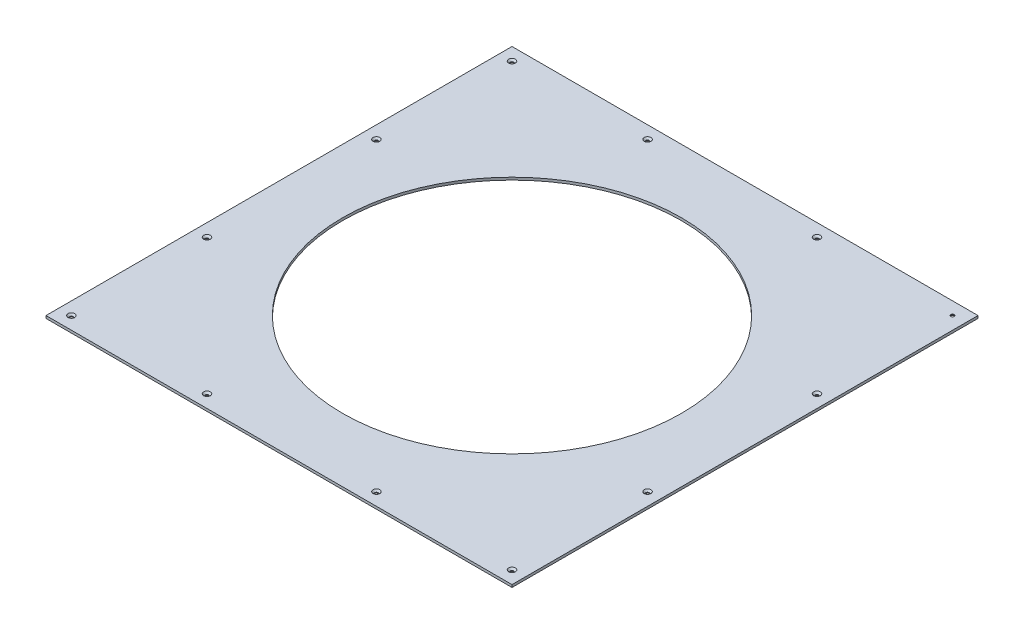
from build123d import *

# Parameters (mm, degrees)
SKETCH_1_W          = 550
SKETCH_1_H          = 550
SKETCH_1_R          = 200
EXTRUDE_1_DEPTH     = 3
SKETCH_2_R          = 2
CUT_EXTRUDE_1_DEPTH = 389.920300319
CHAMFER_1_SIZE      = 2


with BuildPart() as part:
    # 草图1 → 凸台-拉伸1 (new body)
    with BuildSketch(Plane(origin=(0, 0, 0), x_dir=(1, 0, 0), z_dir=(0, 1, 0))):
        Rectangle(SKETCH_1_W, SKETCH_1_H)
        with Locations(Location((0, 0, 0), (0, 0, 270))):
            Circle(SKETCH_1_R, mode=Mode.SUBTRACT)
    extrude(amount=EXTRUDE_1_DEPTH)

    # 草图2 → 切除-拉伸1 (cut, through all)
    with BuildSketch(Plane(origin=(0, 0, 0), x_dir=(1, 0, 0), z_dir=(0, 1, 0))):
        with Locations(Location((-260, 260, 0), (0, 0, 270))):
            Circle(SKETCH_2_R)
        with Locations(Location((-100, 260, 0), (0, 0, 270))):
            Circle(SKETCH_2_R)
        with Locations(Location((100, 260, 0), (0, 0, 90))):
            Circle(SKETCH_2_R)
        with Locations(Location((260, -100, 0), (0, 0, 90))):
            Circle(SKETCH_2_R)
        with Locations(Location((260, 100, 0), (0, 0, 270))):
            Circle(SKETCH_2_R)
        with Locations(Location((260, 260, 0), (0, 0, 270))):
            Circle(SKETCH_2_R)
        with Locations(Location((-100, -260, 0), (0, 0, 90))):
            Circle(SKETCH_2_R)
        with Locations(Location((100, -260, 0), (0, 0, 270))):
            Circle(SKETCH_2_R)
        with Locations(Location((260, -260, 0), (0, 0, 270))):
            Circle(SKETCH_2_R)
        with Locations(Location((-260, 100, 0), (0, 0, 90))):
            Circle(SKETCH_2_R)
        with Locations(Location((-260, -100, 0), (0, 0, 270))):
            Circle(SKETCH_2_R)
        with Locations(Location((-260, -260, 0), (0, 0, 270))):
            Circle(SKETCH_2_R)
    extrude(amount=CUT_EXTRUDE_1_DEPTH, mode=Mode.SUBTRACT)

    # 倒角1
    chamfer_1_edges = [part.edges().sort_by_distance(p)[0] for p in [
        (-260, 3, -98),
        (-260, 3, 98),
        (-260, 3, 258),
        (-100, 3, 262),
        (100, 3, 258),
        (260, 3, 258),
        (260, 3, 102),
        (260, 3, -102),
        (260, 0, -262),
        (100, 3, -258),
        (-100, 3, -262),
        (-260, 3, -262),
    ]]
    chamfer(chamfer_1_edges, length=CHAMFER_1_SIZE)


solid = part.part
